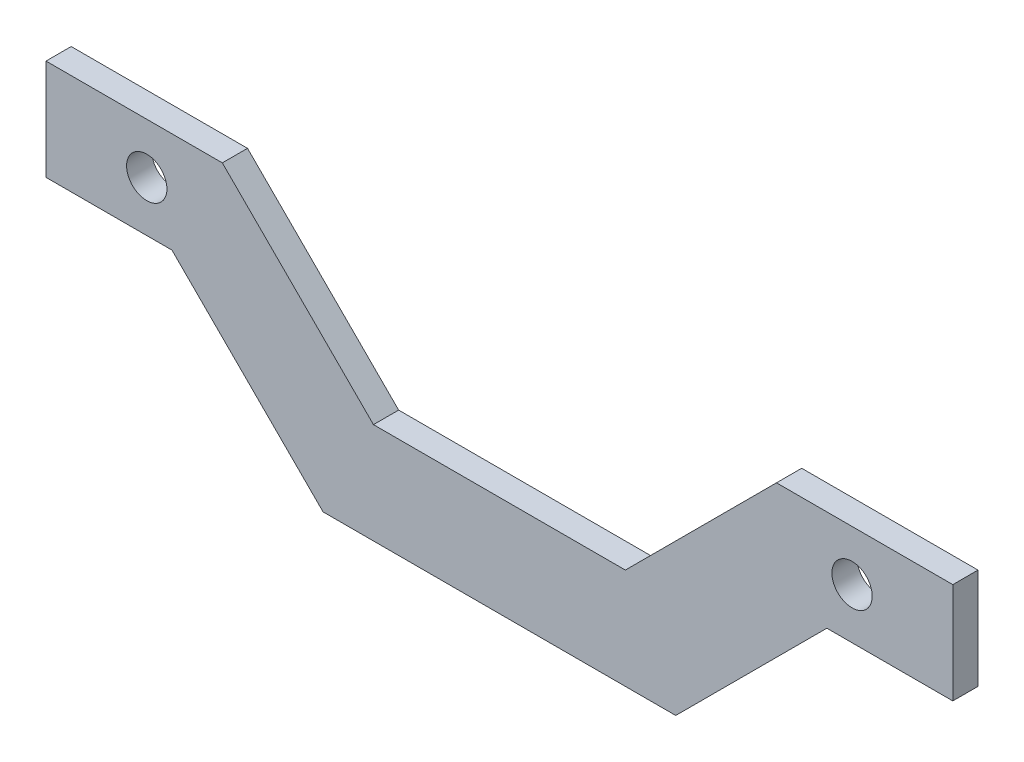
from build123d import *

# Parameters (mm, degrees)
EXTRUDE_1_DEPTH     = 5
SKETCH_2_R          = 4
CUT_EXTRUDE_1_DEPTH = 10


with BuildPart() as part:
    # 草图1 → 凸台-拉伸1 (new body)
    with BuildSketch(Plane.XY):
        Polygon((35, 0), (-35, 0), (-65, 30), (-90, 30), (-90, 50), (-55, 50), (-25, 20), (25, 20), (55, 50), (90, 50), (90, 30), (65, 30), align=None)
    extrude(amount=EXTRUDE_1_DEPTH)

    # 草图2 → 切除-拉伸1 (cut)
    with BuildSketch(Plane(origin=(0, 0, 0), x_dir=(-1, 0, 0), z_dir=(0, 0, -1))):
        with Locations((70, 40)):
            Circle(SKETCH_2_R)
        with Locations(Location((-70, 40, 0), (0, 0, 180))):
            Circle(SKETCH_2_R)
    extrude(amount=-CUT_EXTRUDE_1_DEPTH, mode=Mode.SUBTRACT)


solid = part.part
